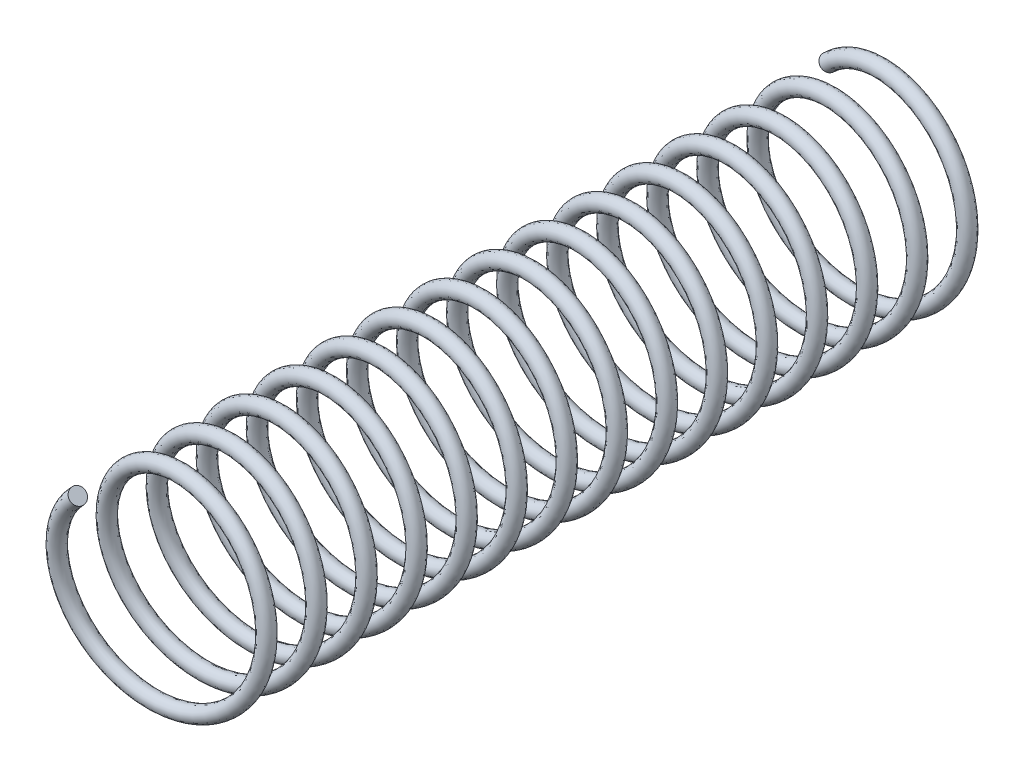
from build123d import *

# Parameters (mm, degrees)
SWEEP1_PITCH       = 4.148666667
SWEEP1_HEIGHT      = 62.23
SWEEP1_RADIUS      = 7.62
SWEEP1_START_ANGLE = 135
SKETCH2_R          = 0.635


with BuildPart() as part:
    # Sweep1: sweep along a helix
    with BuildLine() as sweep1_path:
        add(Helix(SWEEP1_PITCH, SWEEP1_HEIGHT, SWEEP1_RADIUS, center=(0, 0, 0), direction=(0, 0, 1), lefthand=True, mode=Mode.PRIVATE).rotate(Axis((0, 0, 0), (0, 0, 1)), SWEEP1_START_ANGLE))
    # Sketch2 → Sweep1 (sweep)
    with BuildSketch(Plane(origin=(-5.388153673, 5.388153673, 62.23), x_dir=(0.06104278879397381, 0.06104278879396627, -0.9962668095809022), z_dir=(0.7044670169258924, 0.7044670169255932, 0.08632753979750882))):
        Circle(SKETCH2_R)
    sweep(path=sweep1_path.line, is_frenet=True)


solid = part.part
